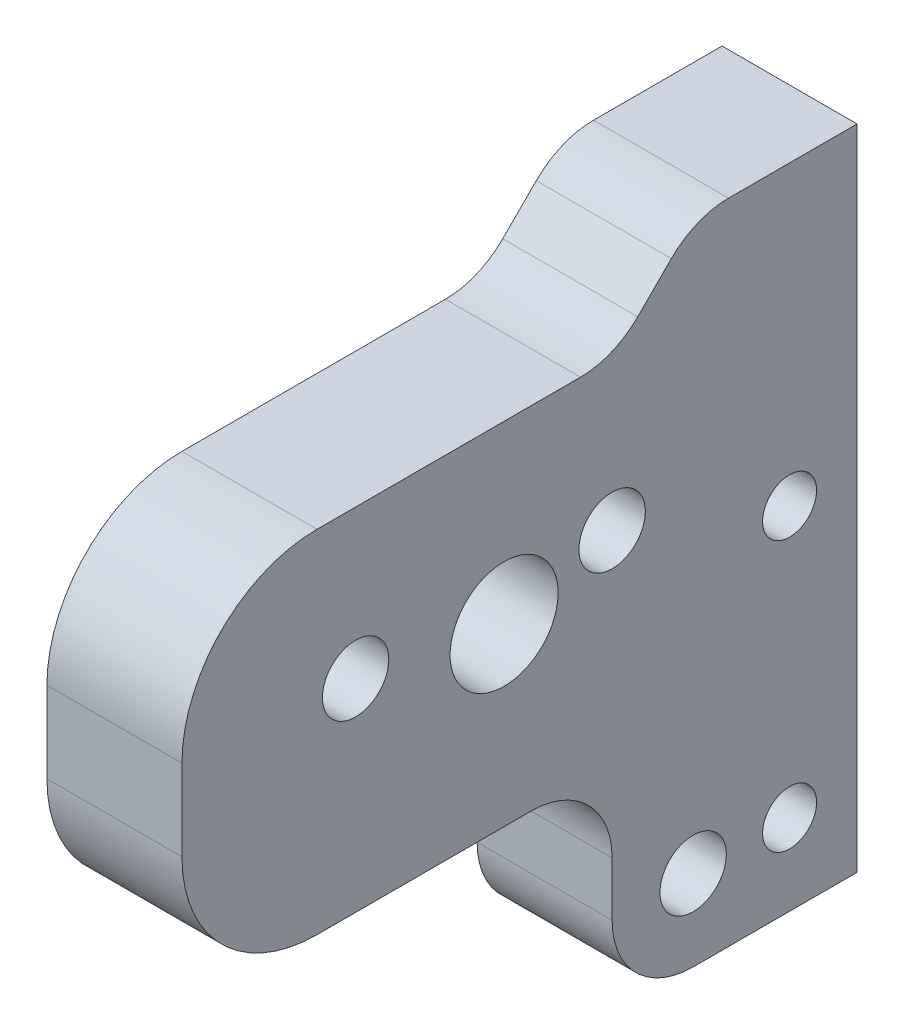
from build123d import *

# Parameters (mm, degrees)
SKETCH1_R           = 1.2295
SKETCH1_R_2         = 2
SKETCH1_R_3         = 1
BOSS_EXTRUDE1_DEPTH = 5
SKETCH2_R           = 1.25
CUT_EXTRUDE1_DEPTH  = 5
FILLET1_R           = 5


with BuildPart() as part:
    # Sketch1 → Boss-Extrude1 (new body)
    with BuildSketch(Plane.YZ):
        with BuildLine():
            Line((-11.729138766, -13.432284692), (-11.729138766, -7.362284692))
            ThreePointArc((-11.729138766, -7.362284692), (-10.85045911, -5.240964348), (-8.729138766, -4.362284692))
            Line((-8.729138766, -4.362284692), (-6.729138766, -4.362284692))
            ThreePointArc((-6.729138766, -4.362284692), (-4.607818422, -3.483605035), (-3.729138766, -1.362284692))
            Line((-3.729138766, -1.362284692), (-3.729138766, 11.567715308))
            Line((-3.729138766, 11.567715308), (9.270861234, 11.567715308))
            Line((9.270861234, 11.567715308), (9.270861234, 8.567715308))
            Line((9.270861234, 8.567715308), (9.270861234, -3.189644004))
            ThreePointArc((9.270861234, -3.189644004), (9.499222636, -4.337694301), (10.14954089, -5.310964348))
            Line((10.14954089, -5.310964348), (11.392181578, -6.553605035))
            ThreePointArc((11.392181578, -6.553605035), (12.042499832, -7.526875082), (12.270861234, -8.674925379))
            Line((12.270861234, -8.674925379), (12.270861234, -13.432284692))
            Line((12.270861234, -13.432284692), (-11.729138766, -13.432284692))
        make_face()
        with Locations(Location((3.770861234, 5.137715308, 0), (0, 0, 270))):
            Circle(SKETCH1_R, mode=Mode.SUBTRACT)
        with Locations(Location((2.770861234, -0.362284692, 0), (0, 0, 270))):
            Circle(SKETCH1_R_2, mode=Mode.SUBTRACT)
        with Locations(Location((3.770861234, -4.362284692, 0), (0, 0, 270))):
            Circle(SKETCH1_R, mode=Mode.SUBTRACT)
        with Locations(Location((-8.729138766, -7.362284692, 0), (0, 0, 270))):
            Circle(SKETCH1_R, mode=Mode.SUBTRACT)
        with Locations(Location((-8.729138766, -10.932284692, 0), (0, 0, 270))):
            Circle(SKETCH1_R_3, mode=Mode.SUBTRACT)
        with Locations(Location((1.270861234, -10.932284692, 0), (0, 0, 270))):
            Circle(SKETCH1_R_3, mode=Mode.SUBTRACT)
    extrude(amount=BOSS_EXTRUDE1_DEPTH)

    # Sketch2 → Cut-Extrude1 (cut)
    with BuildSketch(Plane(origin=(0, 0, -13.432284692), x_dir=(1, 0, 0), z_dir=(0, 0, -1))):
        with Locations(Location((2.5, -8.770861234, 0), (0, 0, 180))):
            Circle(SKETCH2_R)
        with Locations(Location((2.5, 5.229138766, 0), (0, 0, 180))):
            Circle(SKETCH2_R)
    extrude(amount=-CUT_EXTRUDE1_DEPTH, mode=Mode.SUBTRACT)

    # Fillet1
    fillet1_edges = [part.edges().sort_by_distance(p)[0] for p in [
        (2.5, -3.729138766, 11.567715308),
        (2.5, 9.270861234, 11.567715308),
    ]]
    fillet(fillet1_edges, radius=FILLET1_R)


solid = part.part
